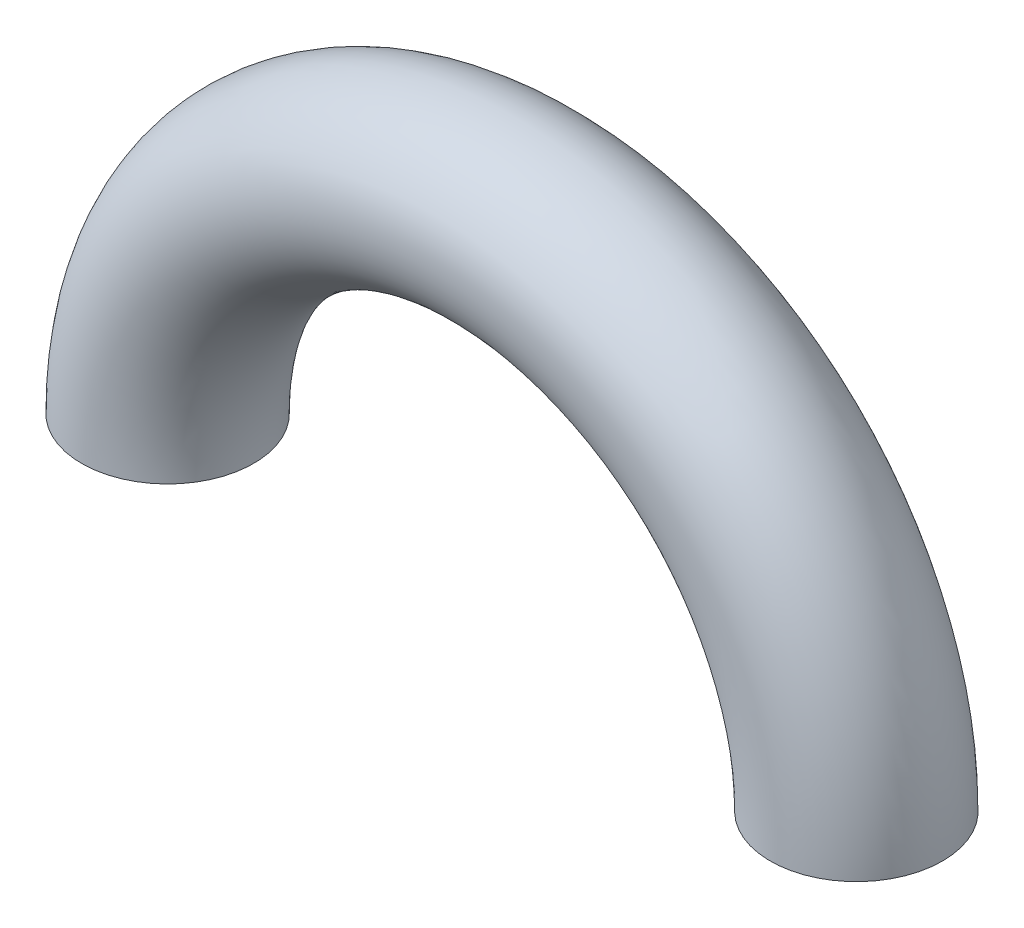
from build123d import *

# Parameters (mm, degrees)
SKETCH2_R = 2.5


with BuildPart() as part:
    # Sweep1: sweep along a path in Sketch3
    with BuildLine(Plane.XY) as sweep1_path:
        ThreePointArc((20, 0), (10, 10), (0, 0))
    # Sketch2 → Sweep1 (sweep)
    with BuildSketch(Plane(origin=(0, 0, 0), x_dir=(1, 0, 0), z_dir=(0, 1, 0))):
        Circle(SKETCH2_R)
    sweep(path=sweep1_path.line)


solid = part.part
